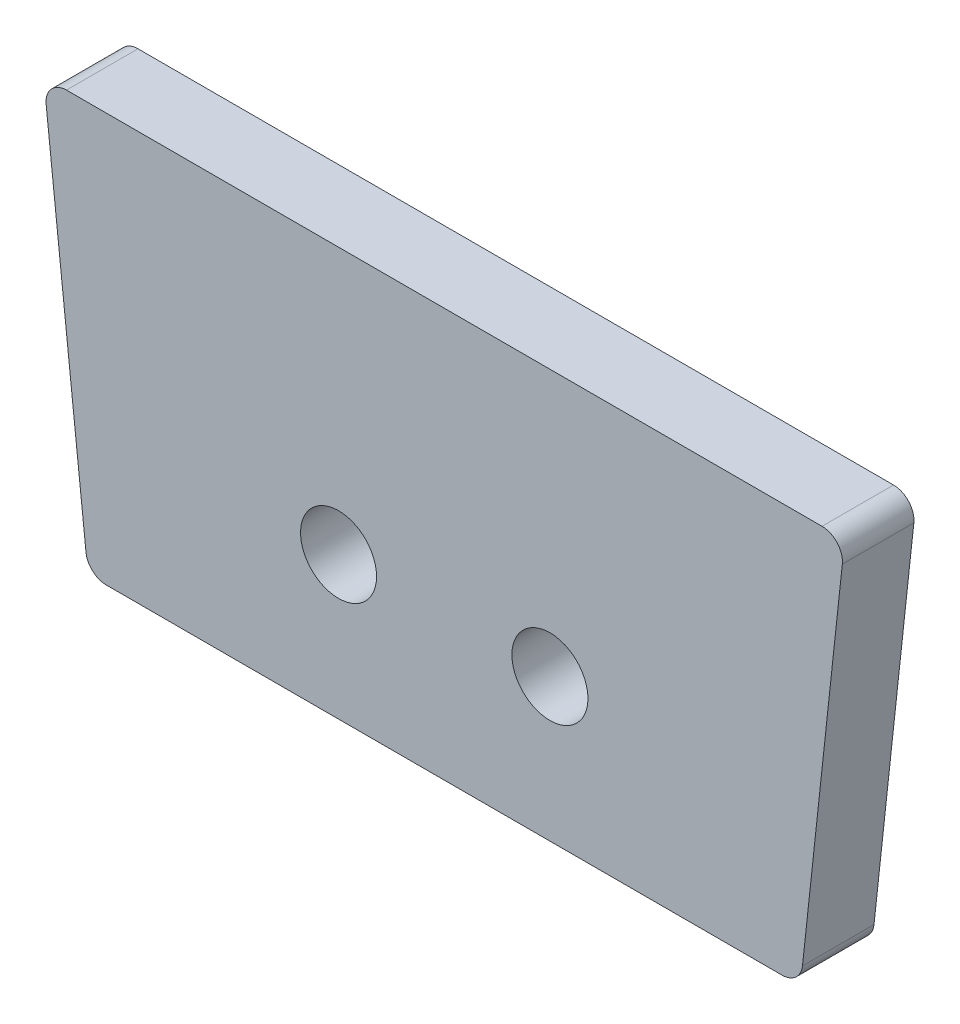
from build123d import *

# Parameters (mm, degrees)
SKETCH_1_R      = 1.85956852
EXTRUDE_1_DEPTH = 3.5
FILLET_1_R      = 1


with BuildPart() as part:
    # 草图1 → 凸台-拉伸1 (new body)
    with BuildSketch(Plane.XY):
        Polygon((-17.433454878, -14.332572831), (-19.600121545, 5.667427169), (19.600121545, 5.667427169), (17.433454878, -14.332572831), align=None)
        with Locations((-5.171924947, -7.35919088)):
            Circle(SKETCH_1_R, mode=Mode.SUBTRACT)
        with Locations(Location((5.171924947, -7.35919088, 0), (0, 0, 180))):
            Circle(SKETCH_1_R, mode=Mode.SUBTRACT)
    extrude(amount=EXTRUDE_1_DEPTH)

    # 圆角1
    fillet_1_edges = [part.edges().sort_by_distance(p)[0] for p in [
        (-17.433454878, -14.332572831, 1.75),
        (-19.600121545, 5.667427169, 1.75),
        (19.600121545, 5.667427169, 1.75),
        (17.433454878, -14.332572831, 1.75),
    ]]
    fillet(fillet_1_edges, radius=FILLET_1_R)


solid = part.part
